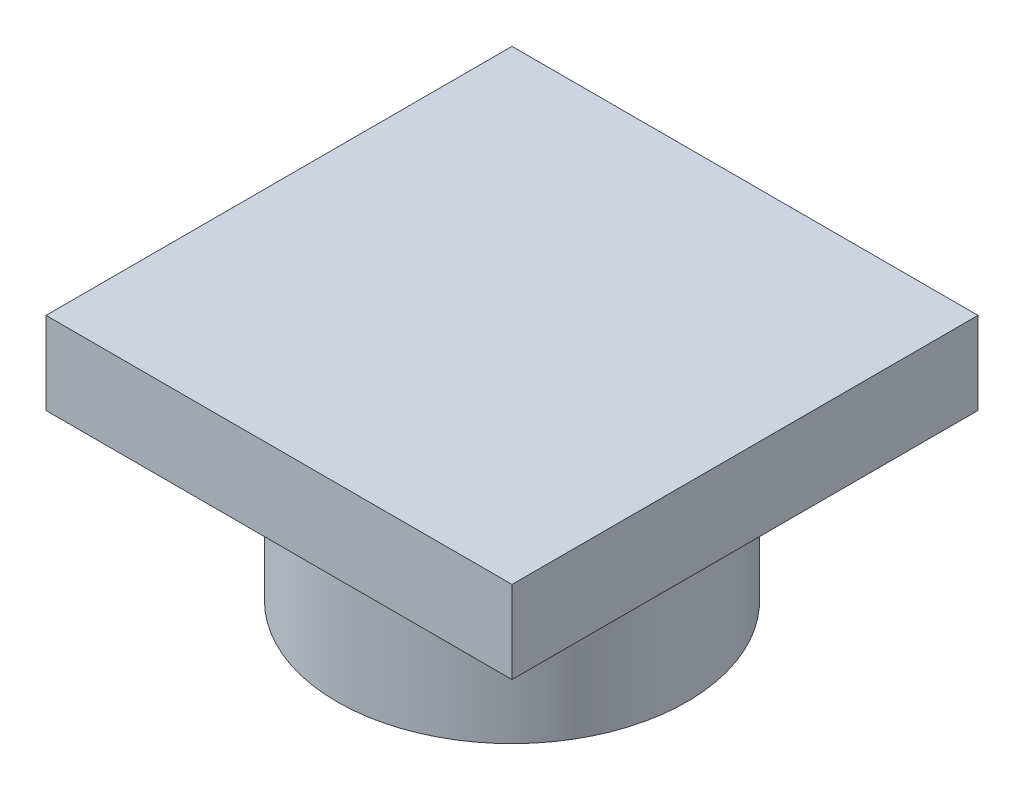
from build123d import *

# Parameters (mm, degrees)
SKETCH1_R           = 4.25
BOSS_EXTRUDE1_DEPTH = 4
SKETCH2_W           = 11.313708498
SKETCH2_H           = 11.313708498
BOSS_EXTRUDE2_DEPTH = 2
SKETCH3_R           = 4.1
CUT_EXTRUDE1_DEPTH  = 2


with BuildPart() as part:
    # Sketch1 → Boss-Extrude1 (new body)
    with BuildSketch(Plane(origin=(0, 0, 0), x_dir=(1, 0, 0), z_dir=(0, 1, 0))):
        with Locations(Location((0, 0, 0), (0, 0, 270))):
            Circle(SKETCH1_R)
    extrude(amount=BOSS_EXTRUDE1_DEPTH)

    # Sketch2 → Boss-Extrude2 (add)
    with BuildSketch(Plane(origin=(0, 4, 0), x_dir=(1, 0, 0), z_dir=(0, 1, 0))):
        Rectangle(SKETCH2_W, SKETCH2_H)
    extrude(amount=BOSS_EXTRUDE2_DEPTH)

    # Sketch3 → Cut-Extrude1 (cut)
    with BuildSketch(Plane.XZ):
        with Locations(Location((0, 0, 0), (0, 0, 270))):
            Circle(SKETCH3_R)
    extrude(amount=-CUT_EXTRUDE1_DEPTH, mode=Mode.SUBTRACT)


solid = part.part
